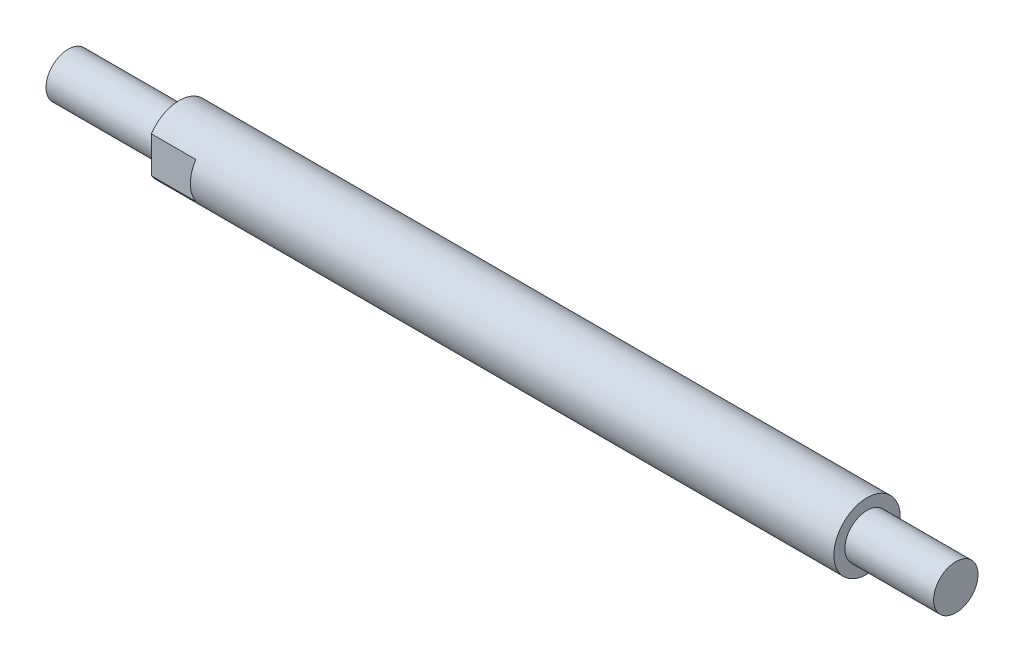
from build123d import *

# Parameters (mm, degrees)
SKETCH1_R           = 4.745
BASE_EXTRUDE_DEPTH  = 114.3
SKETCH2_R           = 3.175
BOSS_EXTRUDE1_DEPTH = 12.7
SKETCH3_R           = 4.745
SKETCH3_R_2         = 3.175
CUT_EXTRUDE1_DEPTH  = 15.875
CUT_EXTRUDE2_DEPTH  = 6.35


with BuildPart() as part:
    # Sketch1 → Base-Extrude (new body)
    with BuildSketch(Plane(origin=(0, 0, 0), x_dir=(0, 0, -1), z_dir=(1, 0, 0))):
        Circle(SKETCH1_R)
    extrude(amount=BASE_EXTRUDE_DEPTH)

    # Sketch2 → Boss-Extrude1 (add)
    with BuildSketch(Plane(origin=(114.3, 0, 0), x_dir=(0, 0, -1), z_dir=(1, 0, 0))):
        Circle(SKETCH2_R)
    extrude(amount=BOSS_EXTRUDE1_DEPTH)

    # Sketch3 → Cut-Extrude1 (cut)
    with BuildSketch(Plane.ZY):
        Circle(SKETCH3_R)
        with Locations(Location((0, 0, 0), (0, 0, 180))):
            Circle(SKETCH3_R_2, mode=Mode.SUBTRACT)
    extrude(amount=-CUT_EXTRUDE1_DEPTH, mode=Mode.SUBTRACT)

    # Sketch4 → Cut-Extrude2 (cut)
    with BuildSketch(Plane.ZY.offset(-15.875)):
        with BuildLine():
            Line((3.96875, 2.600778429), (3.96875, -2.600778429))
            ThreePointArc((3.96875, -2.600778429), (4.745, 0), (3.96875, 2.600778429))
        make_face()
        with BuildLine():
            Line((-3.96875, -2.600778429), (-3.96875, 2.600778429))
            ThreePointArc((-3.96875, 2.600778429), (-4.745, 0), (-3.96875, -2.600778429))
        make_face()
    extrude(amount=-CUT_EXTRUDE2_DEPTH, mode=Mode.SUBTRACT)


solid = part.part
